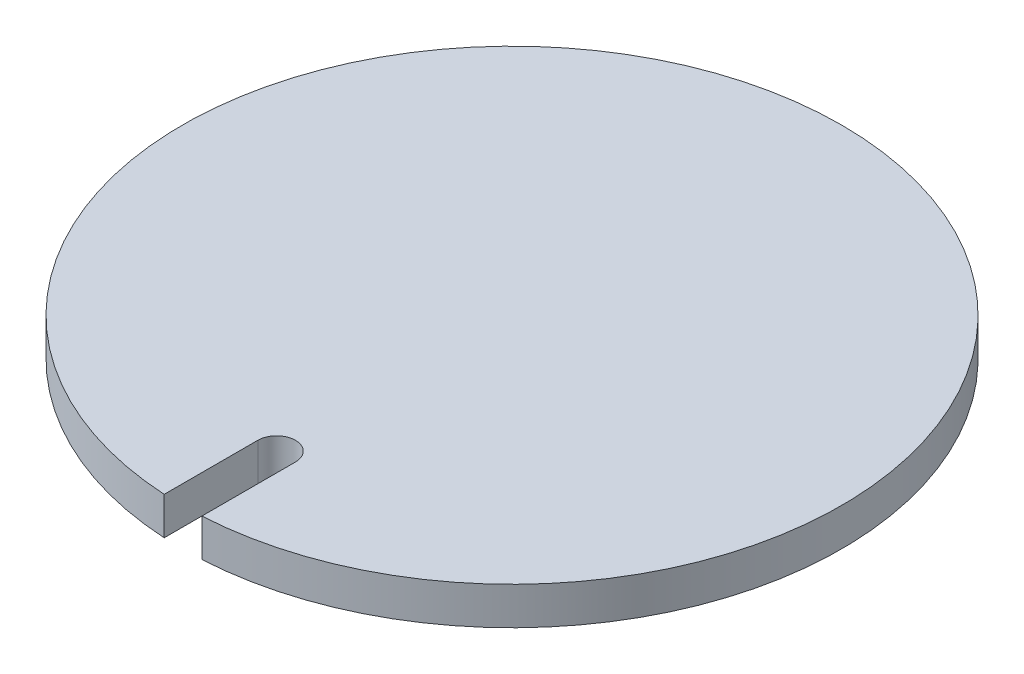
from build123d import *

# Parameters (mm, degrees)
BOSS_EXTRUDE1_DEPTH = 1


with BuildPart() as part:
    # Sketch1 → Boss-Extrude1 (new body)
    with BuildSketch(Plane(origin=(0, 0, 0), x_dir=(1, 0, 0), z_dir=(0, 1, 0))):
        with BuildLine():
            ThreePointArc((8.75, 0), (-6.00780742, 6.361505325), (-0.5, -8.735702605))
            Line((-0.5, -8.735702605), (-0.5, -6.25))
            ThreePointArc((-0.5, -6.25), (0, -5.75), (0.5, -6.25))
            Line((0.5, -6.25), (0.5, -8.735702605))
            ThreePointArc((0.5, -8.735702605), (6.361505325, -6.00780742), (8.75, 0))
        make_face()
    extrude(amount=BOSS_EXTRUDE1_DEPTH)


solid = part.part
